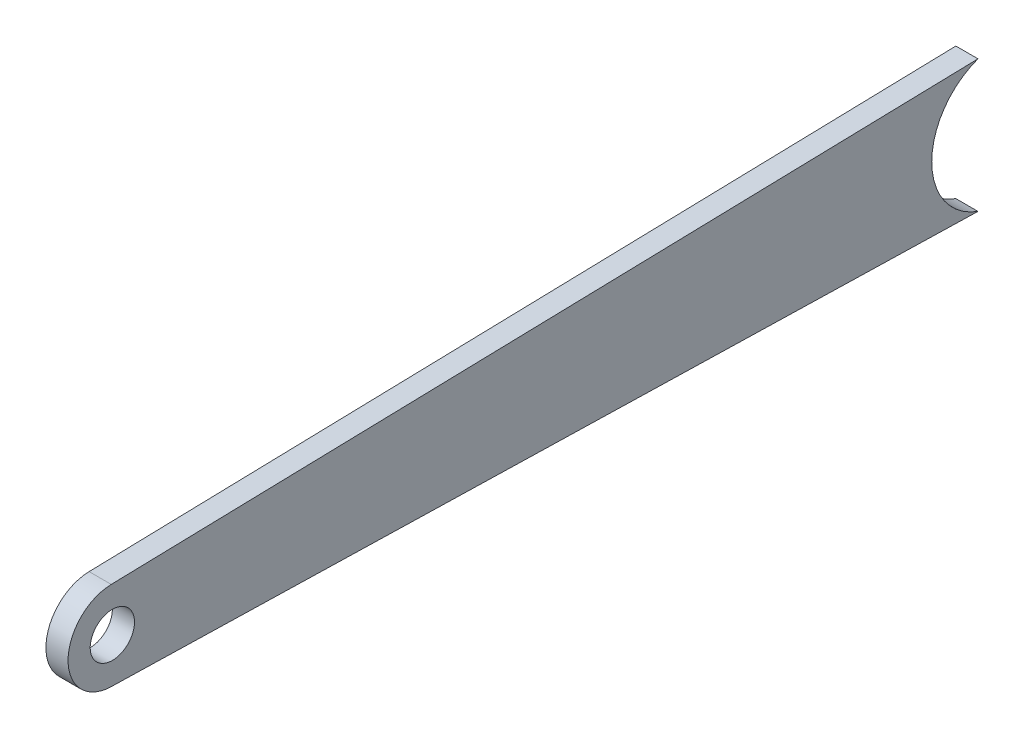
from build123d import *

# Parameters (mm, degrees)
SKETCH1_R           = 5
BOSS_EXTRUDE1_DEPTH = 2.5


with BuildPart() as part:
    # Sketch1 → Boss-Extrude1 (new, symmetric)
    with BuildSketch(Plane.YZ):
        with BuildLine():
            Line((14.917620355, 5.429569775), (9.996840164, 201.126369737))
            ThreePointArc((9.996840164, 201.126369737), (0, 210.875), (-9.996840164, 201.126369737))
            Line((-9.996840164, 201.126369737), (-14.917620355, 5.429569775))
            ThreePointArc((-14.917620355, 5.429569775), (0, 15.875), (14.917620355, 5.429569775))
        make_face()
        with Locations(Location((0, 200.875, 0), (0, 0, 270))):
            Circle(SKETCH1_R, mode=Mode.SUBTRACT)
    extrude(amount=BOSS_EXTRUDE1_DEPTH, both=True)


solid = part.part
